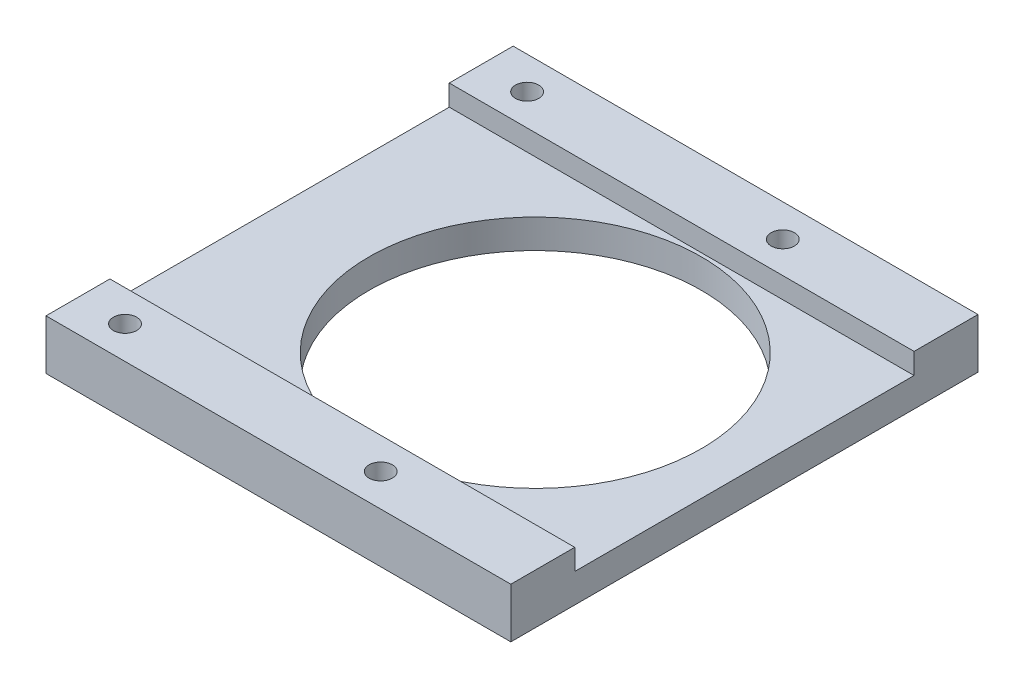
from build123d import *

# Parameters (mm, degrees)
SKETCH_1_W          = 40
SKETCH_1_H          = 40.2
SKETCH_1_R          = 14.3
EXTRUDE_1_DEPTH     = 2.5
SKETCH_2_W          = 40
SKETCH_2_H          = 5.5
EXTRUDE_2_DEPTH     = 1.8
CUT_EXTRUDE_1_REACH = 32.108
SKETCH_3_R          = 1


with BuildPart() as part:
    # 草图1 → 凸台-拉伸1 (new body)
    with BuildSketch(Plane(origin=(0, 0, 0), x_dir=(1, 0, 0), z_dir=(0, 1, 0))):
        with Locations((-2, 0)):
            Rectangle(SKETCH_1_W, SKETCH_1_H)
        with Locations(Location((0, 0, 0), (0, 0, 270))):
            Circle(SKETCH_1_R, mode=Mode.SUBTRACT)
    extrude(amount=EXTRUDE_1_DEPTH)

    # 草图2 → 凸台-拉伸2 (add)
    with BuildSketch(Plane(origin=(0, 2.5, 0), x_dir=(1, 0, 0), z_dir=(0, 1, 0))):
        with Locations((-2, 17.35)):
            Rectangle(SKETCH_2_W, SKETCH_2_H)
        with Locations((-2, -17.35)):
            Rectangle(SKETCH_2_W, SKETCH_2_H)
    extrude(amount=EXTRUDE_2_DEPTH)

    # 草图3 → 切除-拉伸1 (cut, up to next)
    with BuildSketch(Plane(origin=(0, 4.3, 0), x_dir=(1, 0, 0), z_dir=(0, 1, 0)), mode=Mode.PRIVATE) as cut_extrude_1_sk1:
        with Locations(Location((4, 17.3, 0), (0, 0, 270))):
            Circle(SKETCH_3_R)
    cut_extrude_1_tool1 = extrude(cut_extrude_1_sk1.sketch, amount=-CUT_EXTRUDE_1_REACH, mode=Mode.PRIVATE) & part.part
    # 草图3 → 切除-拉伸1 (cut, up to next)
    with BuildSketch(Plane(origin=(0, 4.3, 0), x_dir=(1, 0, 0), z_dir=(0, 1, 0)), mode=Mode.PRIVATE) as cut_extrude_1_sk2:
        with Locations(Location((-18, 17.3, 0), (0, 0, 270))):
            Circle(SKETCH_3_R)
    cut_extrude_1_tool2 = extrude(cut_extrude_1_sk2.sketch, amount=-CUT_EXTRUDE_1_REACH, mode=Mode.PRIVATE) & part.part
    # 草图3 → 切除-拉伸1 (cut, up to next)
    with BuildSketch(Plane(origin=(0, 4.3, 0), x_dir=(1, 0, 0), z_dir=(0, 1, 0)), mode=Mode.PRIVATE) as cut_extrude_1_sk3:
        with Locations(Location((-18, -17.3, 0), (0, 0, 270))):
            Circle(SKETCH_3_R)
    cut_extrude_1_tool3 = extrude(cut_extrude_1_sk3.sketch, amount=-CUT_EXTRUDE_1_REACH, mode=Mode.PRIVATE) & part.part
    # 草图3 → 切除-拉伸1 (cut, up to next)
    with BuildSketch(Plane(origin=(0, 4.3, 0), x_dir=(1, 0, 0), z_dir=(0, 1, 0)), mode=Mode.PRIVATE) as cut_extrude_1_sk4:
        with Locations(Location((4, -17.3, 0), (0, 0, 270))):
            Circle(SKETCH_3_R)
    cut_extrude_1_tool4 = extrude(cut_extrude_1_sk4.sketch, amount=-CUT_EXTRUDE_1_REACH, mode=Mode.PRIVATE) & part.part
    add(cut_extrude_1_tool1.solids().sort_by_distance((4, 4.3, -17.3))[0], mode=Mode.SUBTRACT)
    add(cut_extrude_1_tool2.solids().sort_by_distance((-18, 4.3, -17.3))[0], mode=Mode.SUBTRACT)
    add(cut_extrude_1_tool3.solids().sort_by_distance((-18, 4.3, 17.3))[0], mode=Mode.SUBTRACT)
    add(cut_extrude_1_tool4.solids().sort_by_distance((4, 4.3, 17.3))[0], mode=Mode.SUBTRACT)


solid = part.part
